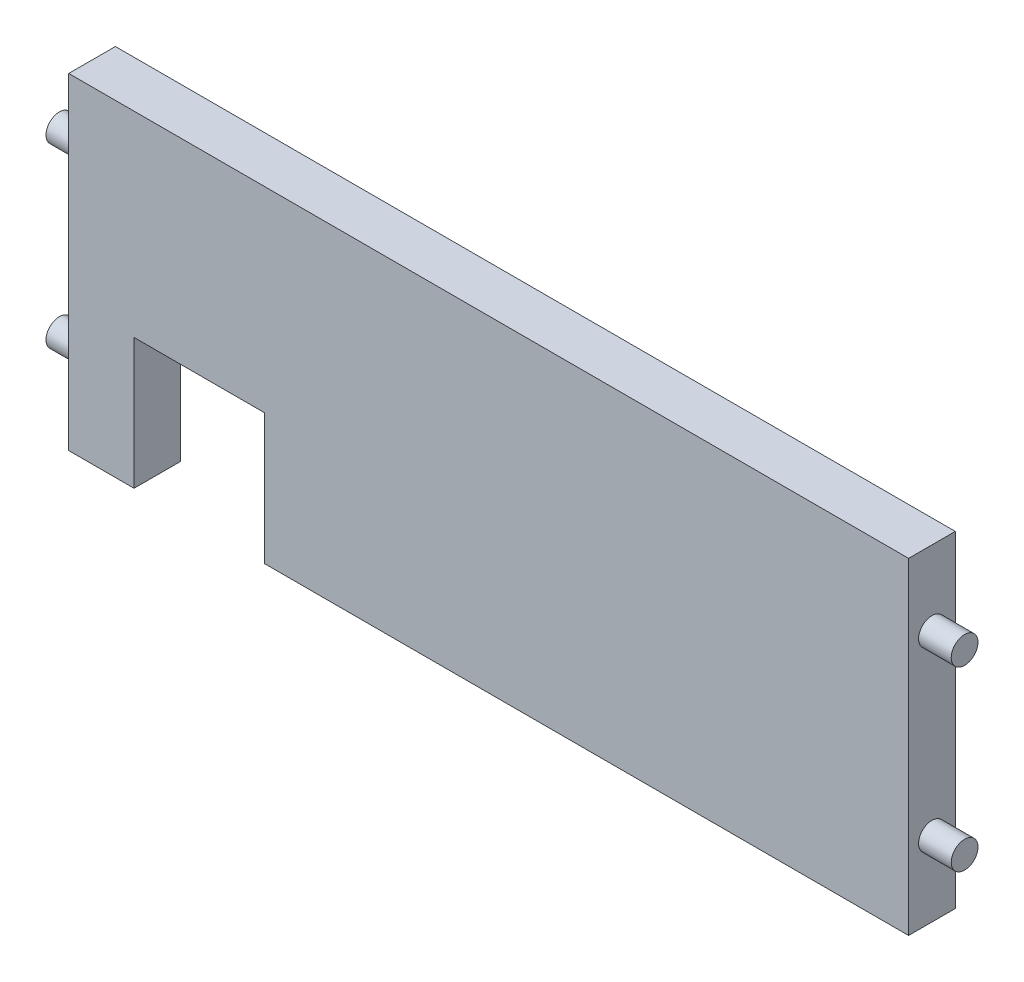
from build123d import *

# Parameters (mm, degrees)
BOSS_EXTRUDE1_DEPTH = 5
SKETCH2_R           = 1.435
BOSS_EXTRUDE2_DEPTH = 3.5
BOSS_EXTRUDE3_START = 3.5
SKETCH3_R           = 1.435
BOSS_EXTRUDE3_DEPTH = 3.5


with BuildPart() as part:
    # Sketch1 → Boss-Extrude1 (new body)
    with BuildSketch(Plane.XY):
        Polygon((-45, 17.5), (-45, -17.5), (-38, -17.5), (-38, -3.5), (-24, -3.5), (-24, -17.5), (-5, -17.5), (5, -17.5), (45, -17.5), (45, 17.5), align=None)
    extrude(amount=BOSS_EXTRUDE1_DEPTH)

    # Sketch2 → Boss-Extrude2 (add)
    with BuildSketch(Plane(origin=(45, 0, 0), x_dir=(0, 0, -1), z_dir=(1, 0, 0))):
        with Locations(Location((-2.5, 9.5, 0), (0, 0, 180))):
            Circle(SKETCH2_R)
        with Locations(Location((-2.5, -9.5, 0), (0, 0, 180))):
            Circle(SKETCH2_R)
    extrude(amount=BOSS_EXTRUDE2_DEPTH)

    # Sketch3 → Boss-Extrude3 (add)
    with BuildSketch(Plane.ZY.offset(45).offset(BOSS_EXTRUDE3_START)):
        with Locations((2.5, 9.5)):
            Circle(SKETCH3_R)
        with Locations((2.5, -9.5)):
            Circle(SKETCH3_R)
    extrude(amount=-BOSS_EXTRUDE3_DEPTH)


solid = part.part
